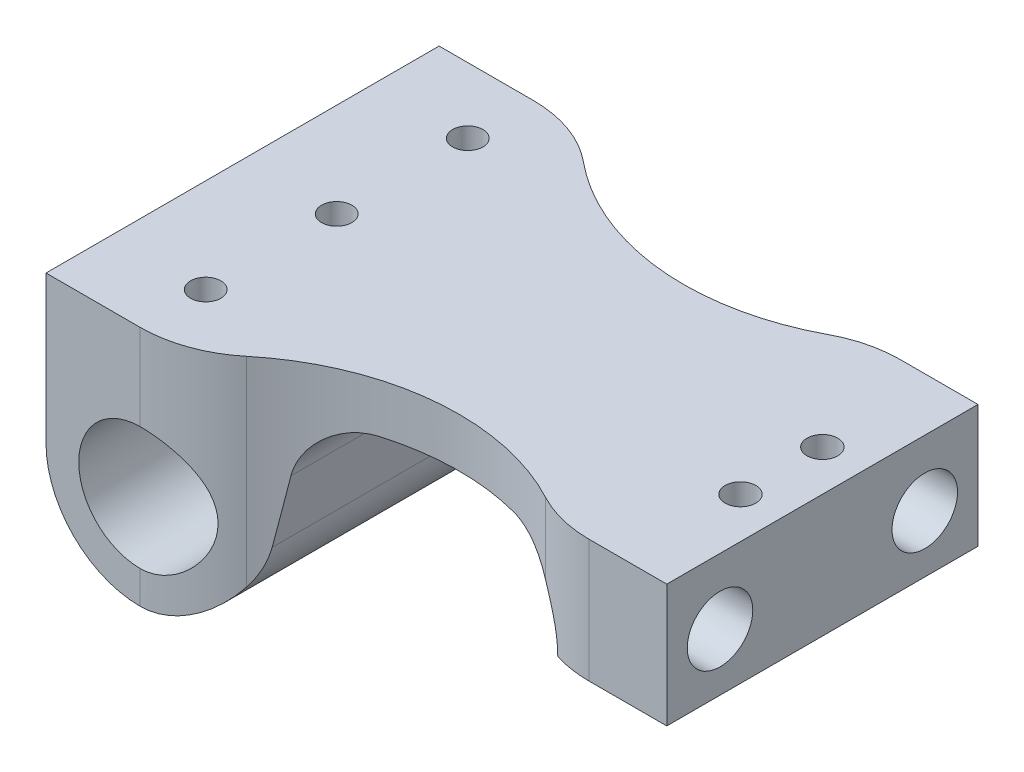
from build123d import *

# Parameters (mm, degrees)
SKETCH1_R               = 7.5
BOSS_EXTRUDE1_DEPTH     = 24
SKETCH2_R               = 4
CUT_EXTRUDE1_DEPTH      = 5
CUT_EXTRUDE2_DEPTH      = 56.410648796
CUT_EXTRUDE2_DEPTH_BACK = 56.410648796
BOSS_EXTRUDE2_START     = 5.5
SKETCH4_W               = 38
SKETCH4_H               = 15
SKETCH4_R               = 4
BOSS_EXTRUDE2_DEPTH     = 5.5
CUT_EXTRUDE3_DEPTH      = 56.410648965
CUT_EXTRUDE3_DEPTH_BACK = 56.410648965
SKETCH5_R               = 1.875
SKETCH6_R               = 1.85
CUT_EXTRUDE4_DEPTH      = 9


with BuildPart() as part:
    # Sketch1 → Boss-Extrude1 (new, symmetric)
    with BuildSketch(Plane.XY):
        with BuildLine():
            Line((-17.47471084, 5.003045957), (-16.099481109, 12.802361333))
            ThreePointArc((-16.099481109, 12.802361333), (-13.534330034, 17.245333323), (-8.713422961, 19))
            Line((-8.713422961, 19), (7.5, 19))
            ThreePointArc((7.5, 19), (13.863961031, 16.363961031), (16.5, 10))
            Line((16.5, 10), (25, 10))
            Line((25, 10), (25, 25))
            Line((25, 25), (12.627503281, 25))
            Line((12.627503281, 25), (-40.3, 25))
            Line((-40.3, 25), (-40.3, 7))
            ThreePointArc((-40.3, 7), (-29.802291042, -4.456239028), (-17.47471084, 5.003045957))
        make_face()
        with Locations((-28.8, 7)):
            Circle(SKETCH1_R, mode=Mode.SUBTRACT)
    extrude(amount=BOSS_EXTRUDE1_DEPTH, both=True)

    # Sketch2 → Cut-Extrude1 (cut)
    with BuildSketch(Plane(origin=(25, 0, 0), x_dir=(0, 0, -1), z_dir=(1, 0, 0))):
        with Locations((-12.5, 17)):
            Circle(SKETCH2_R)
        with Locations((12.5, 17)):
            Circle(SKETCH2_R)
    extrude(amount=-CUT_EXTRUDE1_DEPTH, mode=Mode.SUBTRACT)

    # Sketch3 → Cut-Extrude2 (cut, two sides: drawn at the far end of the back side and taken through both)
    with BuildSketch(Plane(origin=(0, 25, 0), x_dir=(1, 0, 0), z_dir=(0, 1, 0)).offset(-CUT_EXTRUDE2_DEPTH_BACK)):
        with BuildLine():
            Line((-28.8, -24), (25, -24))
            Line((25, -24), (25, -19))
            Line((25, -19), (21, -19))
            ThreePointArc((21, -19), (17.364289008, -18.552718151), (13.94540302, -17.237547411))
            ThreePointArc((13.94540302, -17.237547411), (-3.160771505, -13.862715808), (-19.25459698, -20.570880744))
            ThreePointArc((-19.25459698, -20.570880744), (-23.728669364, -23.116713696), (-28.8, -24))
        make_face()
        with BuildLine():
            Line((21, 19), (25, 19))
            Line((25, 19), (25, 24))
            Line((25, 24), (-28.8, 24))
            ThreePointArc((-28.8, 24), (-23.728669364, 23.116713696), (-19.25459698, 20.570880744))
            ThreePointArc((-19.25459698, 20.570880744), (-3.160771505, 13.862715808), (13.94540302, 17.237547411))
            ThreePointArc((13.94540302, 17.237547411), (17.364289008, 18.552718151), (21, 19))
        make_face()
    extrude(amount=CUT_EXTRUDE2_DEPTH + CUT_EXTRUDE2_DEPTH_BACK, mode=Mode.SUBTRACT)

    # Sketch4 → Boss-Extrude2 (add)
    with BuildSketch(Plane(origin=(25, 0, 0), x_dir=(0, 0, -1), z_dir=(1, 0, 0)).offset(BOSS_EXTRUDE2_START)):
        with Locations((0, 17.5)):
            Rectangle(SKETCH4_W, SKETCH4_H)
        with Locations((12.5, 17)):
            Circle(SKETCH4_R, mode=Mode.SUBTRACT)
        with Locations((-12.5, 17)):
            Circle(SKETCH4_R, mode=Mode.SUBTRACT)
    extrude(amount=-BOSS_EXTRUDE2_DEPTH)

    # Sketch5 → Cut-Extrude3 (cut, two sides: drawn at the far end of the back side and taken through both)
    with BuildSketch(Plane(origin=(0, 25, 0), x_dir=(1, 0, 0), z_dir=(0, 1, 0)).offset(-CUT_EXTRUDE3_DEPTH_BACK)):
        with Locations(Location((25.5, -5, 0), (0, 0, 180))):
            Circle(SKETCH5_R)
        with Locations(Location((25.5, 5, 0), (0, 0, 180))):
            Circle(SKETCH5_R)
    extrude(amount=CUT_EXTRUDE3_DEPTH + CUT_EXTRUDE3_DEPTH_BACK, mode=Mode.SUBTRACT)

    # Sketch6 → Cut-Extrude4 (cut)
    with BuildSketch(Plane(origin=(0, 25, 0), x_dir=(1, 0, 0), z_dir=(0, 1, 0))):
        with Locations(Location((-28.8, 16, 0), (0, 0, 270))):
            Circle(SKETCH6_R)
        with Locations(Location((-28.8, 0, 0), (0, 0, 270))):
            Circle(SKETCH6_R)
        with Locations(Location((-28.8, -16, 0), (0, 0, 270))):
            Circle(SKETCH6_R)
    extrude(amount=-CUT_EXTRUDE4_DEPTH, mode=Mode.SUBTRACT)


solid = part.part
